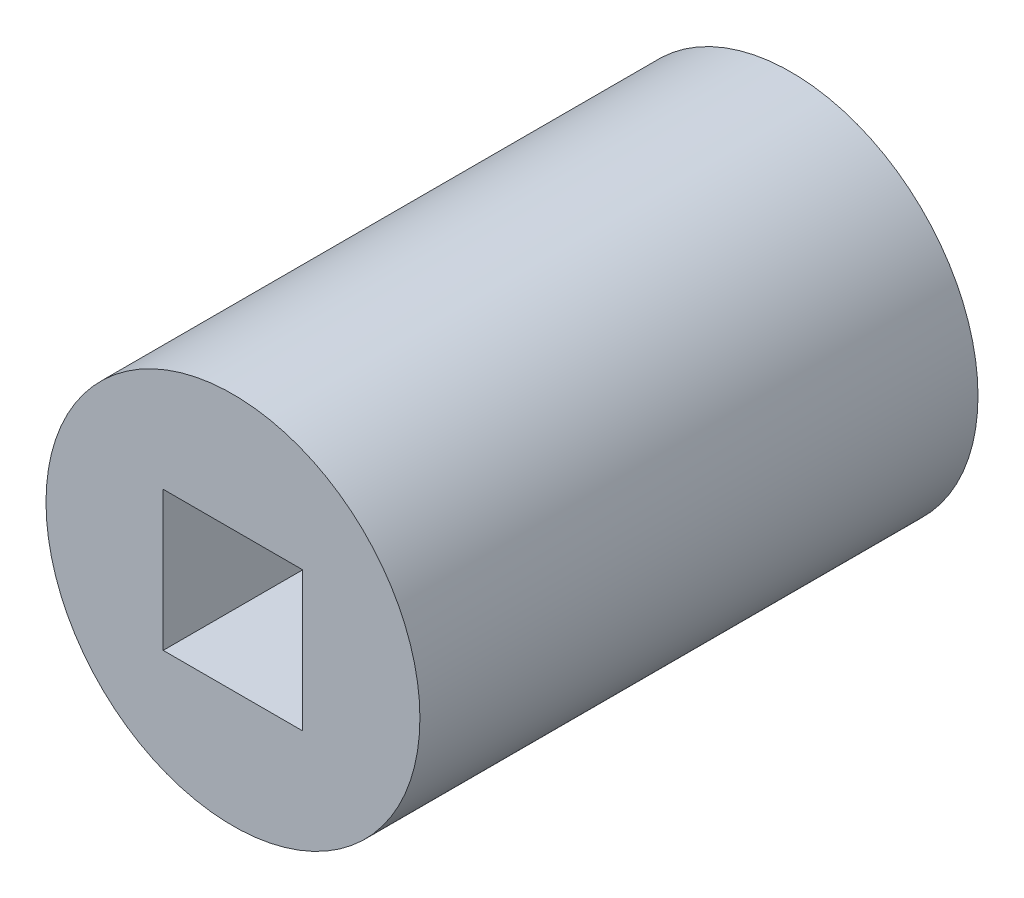
from build123d import *

# Parameters (mm, degrees)
SKETCH1_R           = 3.35
BOSS_EXTRUDE1_DEPTH = 10
SKETCH2_W           = 2.5
SKETCH2_H           = 2.5
CUT_EXTRUDE1_DEPTH  = 5
SKETCH3_R           = 2.35
CUT_EXTRUDE2_DEPTH  = 3
SKETCH4_R           = 1
CUT_EXTRUDE3_DEPTH  = 3


with BuildPart() as part:
    # Sketch1 → Boss-Extrude1 (new body)
    with BuildSketch(Plane.XY):
        Circle(SKETCH1_R)
    extrude(amount=BOSS_EXTRUDE1_DEPTH)

    # Sketch2 → Cut-Extrude1 (cut)
    with BuildSketch(Plane.XY.offset(10)):
        Rectangle(SKETCH2_W, SKETCH2_H)
    extrude(amount=-CUT_EXTRUDE1_DEPTH, mode=Mode.SUBTRACT)

    # Sketch3 → Cut-Extrude2 (cut)
    with BuildSketch(Plane(origin=(0, 0, 0), x_dir=(-1, 0, 0), z_dir=(0, 0, -1))):
        Circle(SKETCH3_R)
    extrude(amount=-CUT_EXTRUDE2_DEPTH, mode=Mode.SUBTRACT)

    # Sketch4 → Cut-Extrude3 (cut)
    with BuildSketch(Plane(origin=(0, 0, 3), x_dir=(-1, 0, 0), z_dir=(0, 0, -1))):
        Circle(SKETCH4_R)
    extrude(amount=-CUT_EXTRUDE3_DEPTH, mode=Mode.SUBTRACT)


solid = part.part
